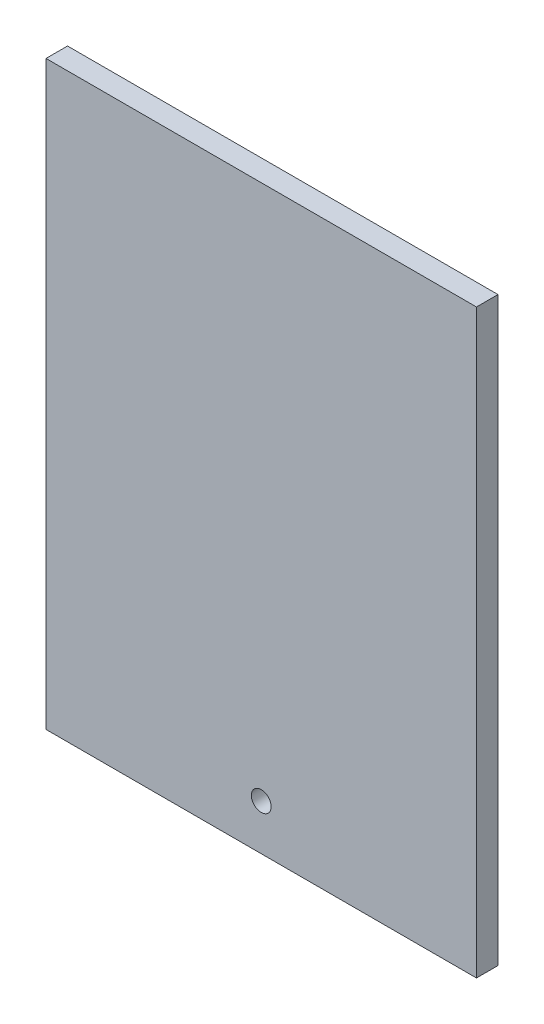
from build123d import *

# Parameters (mm, degrees)
SKETCH1_W           = 127
SKETCH1_H           = 171.45
BOSS_EXTRUDE1_DEPTH = 6.35
SKETCH2_R           = 2.921
CUT_EXTRUDE1_DEPTH  = 107.870707516


with BuildPart() as part:
    # Sketch1 → Boss-Extrude1 (new body)
    with BuildSketch(Plane.XY):
        Rectangle(SKETCH1_W, SKETCH1_H)
    extrude(amount=BOSS_EXTRUDE1_DEPTH)

    # Sketch2 → Cut-Extrude1 (cut, through all)
    with BuildSketch(Plane.XY.offset(6.35)):
        with Locations((0, -72.263)):
            Circle(SKETCH2_R)
    extrude(amount=-CUT_EXTRUDE1_DEPTH, mode=Mode.SUBTRACT)


solid = part.part
